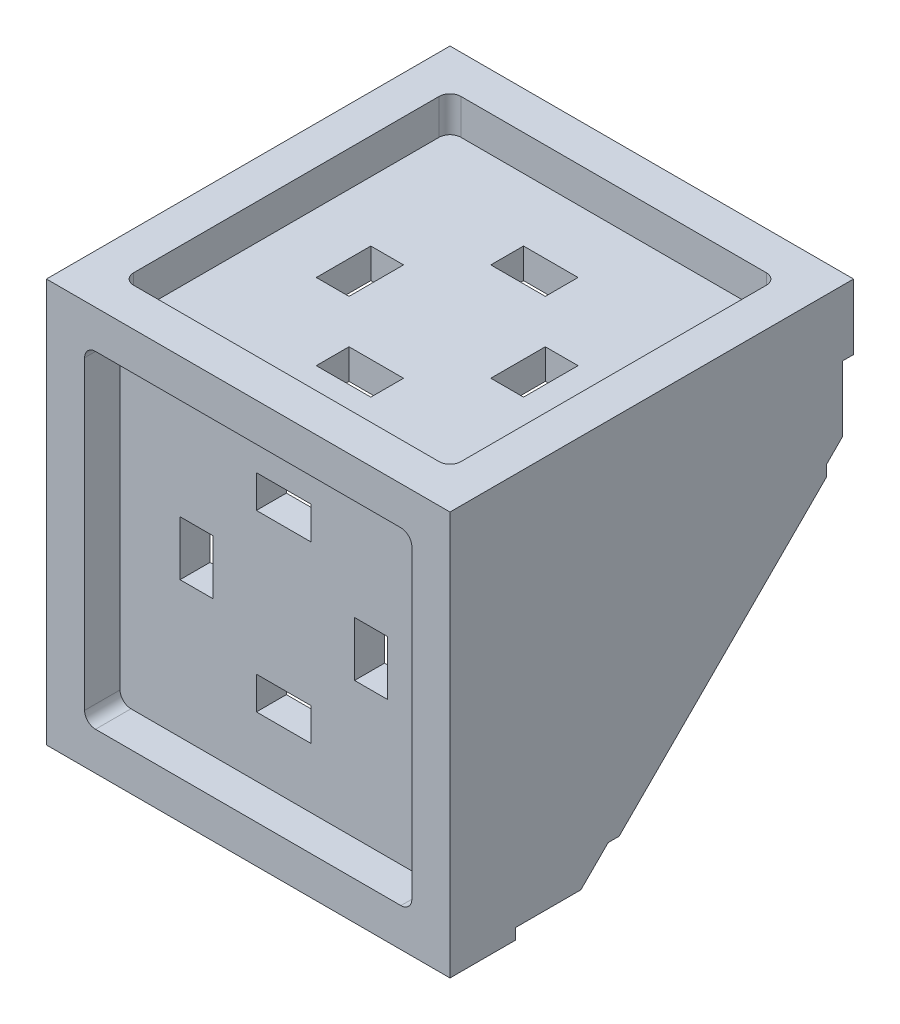
from build123d import *

# Parameters (mm, degrees)
SKETCH1_W           = 18.796
SKETCH1_H           = 18.796
BOSS_EXTRUDE1_DEPTH = 3.048
SKETCH3_W           = 18.796
SKETCH3_H           = 18.796
BOSS_EXTRUDE2_DEPTH = 3.048
SKETCH4_W           = 15.24
SKETCH4_H           = 15.24
CUT_EXTRUDE1_DEPTH  = 1.651
SKETCH5_W           = 15.24
SKETCH5_H           = 15.24
CUT_EXTRUDE2_DEPTH  = 1.651
SKETCH6_W           = 2.54
SKETCH6_H           = 1.524
SKETCH6_W_2         = 1.524
SKETCH6_H_2         = 2.54
CUT_EXTRUDE3_DEPTH  = 1.651
SKETCH7_W           = 2.54
SKETCH7_H           = 1.524
SKETCH7_W_2         = 1.524
SKETCH7_H_2         = 2.54
CUT_EXTRUDE4_DEPTH  = 24.020304603
BOSS_EXTRUDE3_DEPTH = 1.651
FILLET1_R           = 0.508
FILLET2_R           = 0.508


with BuildPart() as part:
    # Sketch1 → Boss-Extrude1 (new body)
    with BuildSketch(Plane.XY):
        Rectangle(SKETCH1_W, SKETCH1_H)
    extrude(amount=-BOSS_EXTRUDE1_DEPTH)

    # Sketch3 → Boss-Extrude2 (add)
    with BuildSketch(Plane(origin=(0, 9.398, 0), x_dir=(1, 0, 0), z_dir=(0, 1, 0))):
        with Locations((0, 9.398)):
            Rectangle(SKETCH3_W, SKETCH3_H)
    extrude(amount=-BOSS_EXTRUDE2_DEPTH)

    # Sketch4 → Cut-Extrude1 (cut)
    with BuildSketch(Plane(origin=(0, 9.398, 0), x_dir=(1, 0, 0), z_dir=(0, 1, 0))):
        with Locations((0, 9.398)):
            Rectangle(SKETCH4_W, SKETCH4_H)
    extrude(amount=-CUT_EXTRUDE1_DEPTH, mode=Mode.SUBTRACT)

    # Sketch5 → Cut-Extrude2 (cut)
    with BuildSketch(Plane.XY):
        Rectangle(SKETCH5_W, SKETCH5_H)
    extrude(amount=-CUT_EXTRUDE2_DEPTH, mode=Mode.SUBTRACT)

    # Sketch6 → Cut-Extrude3 (cut)
    with BuildSketch(Plane(origin=(0, 7.747, 0), x_dir=(1, 0, 0), z_dir=(0, 1, 0))):
        with Locations((0, 5.20193254)):
            Rectangle(SKETCH6_W, SKETCH6_H)
        with Locations((-4.064, 9.26593254)):
            Rectangle(SKETCH6_W_2, SKETCH6_H_2)
        with Locations((4.064, 9.26593254)):
            Rectangle(SKETCH6_W_2, SKETCH6_H_2)
        with Locations((0, 13.32993254)):
            Rectangle(SKETCH6_W, SKETCH6_H)
    extrude(amount=-CUT_EXTRUDE3_DEPTH, mode=Mode.SUBTRACT)

    # Sketch7 → Cut-Extrude4 (cut, through all)
    with BuildSketch(Plane.XY):
        with Locations((0, 4.064)):
            Rectangle(SKETCH7_W, SKETCH7_H)
        with Locations((4.064, 0)):
            Rectangle(SKETCH7_W_2, SKETCH7_H_2)
        with Locations((0, -4.064)):
            Rectangle(SKETCH7_W, SKETCH7_H)
        with Locations((-4.064, 0)):
            Rectangle(SKETCH7_W_2, SKETCH7_H_2)
    extrude(amount=-CUT_EXTRUDE4_DEPTH, mode=Mode.SUBTRACT)

    # Sketch8 → Boss-Extrude3 (add)
    with BuildSketch(Plane(origin=(9.398, 0, 0), x_dir=(0, 0, -1), z_dir=(1, 0, 0))):
        Polygon((3.048, 6.35), (3.048, -8.89), (6.096, -8.89), (7.366, -7.62), (7.874, -7.62), (17.526, 2.032), (17.526, 2.54), (18.288, 3.302), (18.288, 6.35), align=None)
    extrude(amount=-BOSS_EXTRUDE3_DEPTH)

    # Fillet1
    fillet1_edges = [part.edges().sort_by_distance(p)[0] for p in [
        (7.62, 8.5725, -1.778),
        (-7.62, 8.5725, -1.778),
        (-7.62, 8.5725, -17.018),
        (7.62, 8.5725, -17.018),
    ]]
    fillet(fillet1_edges, radius=FILLET1_R)

    # Fillet2
    fillet2_edges = [part.edges().sort_by_distance(p)[0] for p in [
        (-7.62, -7.62, -0.8255),
        (-7.62, 7.62, -0.8255),
        (7.62, 7.62, -0.8255),
        (7.62, -7.62, -0.8255),
    ]]
    fillet(fillet2_edges, radius=FILLET2_R)


solid = part.part
